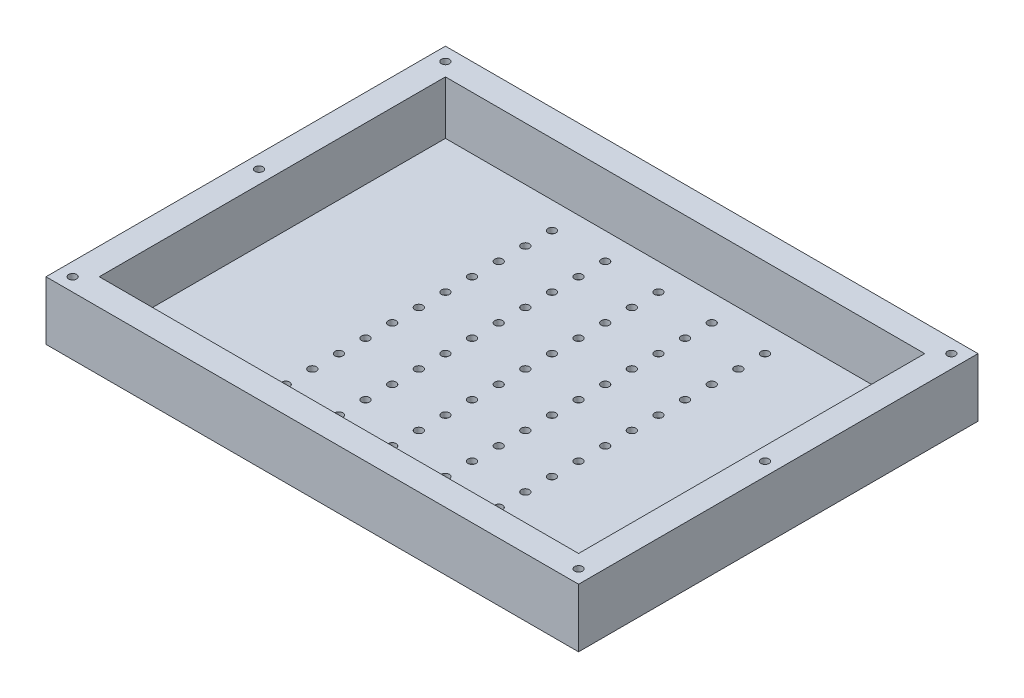
from build123d import *

# Parameters (mm, degrees)
SKETCH1_W           = 200
SKETCH1_H           = 150
BOSS_EXTRUDE1_DEPTH = 2
SKETCH2_R           = 1.5
CUT_EXTRUDE1_DEPTH  = 126.015998976
SKETCH3_W           = 200
SKETCH3_H           = 150
SKETCH3_W_2         = 180
SKETCH3_H_2         = 130
BOSS_EXTRUDE2_DEPTH = 20
SKETCH4_R           = 1.5
CUT_EXTRUDE2_DEPTH  = 127.921235418
SKETCH5_R           = 3
CUT_EXTRUDE3_DEPTH  = 17


with BuildPart() as part:
    # Sketch1 → Boss-Extrude1 (new body)
    with BuildSketch(Plane(origin=(0, 0, 0), x_dir=(1, 0, 0), z_dir=(0, 1, 0))):
        Rectangle(SKETCH1_W, SKETCH1_H)
    extrude(amount=BOSS_EXTRUDE1_DEPTH)

    # Sketch2 → Cut-Extrude1 (cut, through all)
    with BuildSketch(Plane(origin=(0, 2, 0), x_dir=(1, 0, 0), z_dir=(0, 1, 0))):
        with Locations(Location((0, -5, 0), (0, 0, 270))):
            Circle(SKETCH2_R)
        with Locations(Location((0, -15, 0), (0, 0, 270))):
            Circle(SKETCH2_R)
        with Locations(Location((0, -25, 0), (0, 0, 270))):
            Circle(SKETCH2_R)
        with Locations(Location((0, -35, 0), (0, 0, 270))):
            Circle(SKETCH2_R)
        with Locations(Location((0, -45, 0), (0, 0, 270))):
            Circle(SKETCH2_R)
        with Locations(Location((0, -55, 0), (0, 0, 270))):
            Circle(SKETCH2_R)
        with Locations(Location((0, 55, 0), (0, 0, 90))):
            Circle(SKETCH2_R)
        with Locations(Location((0, 45, 0), (0, 0, 90))):
            Circle(SKETCH2_R)
        with Locations(Location((0, 35, 0), (0, 0, 90))):
            Circle(SKETCH2_R)
        with Locations(Location((0, 25, 0), (0, 0, 90))):
            Circle(SKETCH2_R)
        with Locations(Location((0, 15, 0), (0, 0, 90))):
            Circle(SKETCH2_R)
        with Locations(Location((0, 5, 0), (0, 0, 90))):
            Circle(SKETCH2_R)
        with Locations(Location((20, -55, 0), (0, 0, 90))):
            Circle(SKETCH2_R)
        with Locations(Location((20, -45, 0), (0, 0, 90))):
            Circle(SKETCH2_R)
        with Locations(Location((20, -35, 0), (0, 0, 90))):
            Circle(SKETCH2_R)
        with Locations(Location((20, -25, 0), (0, 0, 90))):
            Circle(SKETCH2_R)
        with Locations(Location((20, -15, 0), (0, 0, 90))):
            Circle(SKETCH2_R)
        with Locations(Location((20, -5, 0), (0, 0, 90))):
            Circle(SKETCH2_R)
        with Locations(Location((20, 5, 0), (0, 0, 270))):
            Circle(SKETCH2_R)
        with Locations(Location((20, 15, 0), (0, 0, 270))):
            Circle(SKETCH2_R)
        with Locations(Location((20, 25, 0), (0, 0, 270))):
            Circle(SKETCH2_R)
        with Locations(Location((20, 35, 0), (0, 0, 270))):
            Circle(SKETCH2_R)
        with Locations(Location((20, 45, 0), (0, 0, 270))):
            Circle(SKETCH2_R)
        with Locations(Location((20, 55, 0), (0, 0, 270))):
            Circle(SKETCH2_R)
        with Locations(Location((-20, -55, 0), (0, 0, 90))):
            Circle(SKETCH2_R)
        with Locations(Location((-20, -45, 0), (0, 0, 90))):
            Circle(SKETCH2_R)
        with Locations(Location((-20, -35, 0), (0, 0, 90))):
            Circle(SKETCH2_R)
        with Locations(Location((-20, -25, 0), (0, 0, 90))):
            Circle(SKETCH2_R)
        with Locations(Location((-20, -15, 0), (0, 0, 90))):
            Circle(SKETCH2_R)
        with Locations(Location((-20, -5, 0), (0, 0, 90))):
            Circle(SKETCH2_R)
        with Locations(Location((-20, 5, 0), (0, 0, 270))):
            Circle(SKETCH2_R)
        with Locations(Location((-20, 15, 0), (0, 0, 270))):
            Circle(SKETCH2_R)
        with Locations(Location((-20, 25, 0), (0, 0, 270))):
            Circle(SKETCH2_R)
        with Locations(Location((-20, 35, 0), (0, 0, 270))):
            Circle(SKETCH2_R)
        with Locations(Location((-20, 45, 0), (0, 0, 270))):
            Circle(SKETCH2_R)
        with Locations(Location((-20, 55, 0), (0, 0, 270))):
            Circle(SKETCH2_R)
        with Locations(Location((40, -35, 0), (0, 0, 270))):
            Circle(SKETCH2_R)
        with Locations(Location((40, -45, 0), (0, 0, 270))):
            Circle(SKETCH2_R)
        with Locations(Location((40, -55, 0), (0, 0, 270))):
            Circle(SKETCH2_R)
        with Locations(Location((40, -5, 0), (0, 0, 270))):
            Circle(SKETCH2_R)
        with Locations(Location((40, -15, 0), (0, 0, 270))):
            Circle(SKETCH2_R)
        with Locations(Location((40, -25, 0), (0, 0, 270))):
            Circle(SKETCH2_R)
        with Locations(Location((40, 25, 0), (0, 0, 90))):
            Circle(SKETCH2_R)
        with Locations(Location((40, 15, 0), (0, 0, 90))):
            Circle(SKETCH2_R)
        with Locations(Location((40, 5, 0), (0, 0, 90))):
            Circle(SKETCH2_R)
        with Locations(Location((40, 55, 0), (0, 0, 90))):
            Circle(SKETCH2_R)
        with Locations(Location((40, 45, 0), (0, 0, 90))):
            Circle(SKETCH2_R)
        with Locations(Location((40, 35, 0), (0, 0, 90))):
            Circle(SKETCH2_R)
        with Locations(Location((-40, -55, 0), (0, 0, 270))):
            Circle(SKETCH2_R)
        with Locations(Location((-40, -45, 0), (0, 0, 270))):
            Circle(SKETCH2_R)
        with Locations(Location((-40, -35, 0), (0, 0, 270))):
            Circle(SKETCH2_R)
        with Locations(Location((-40, -25, 0), (0, 0, 270))):
            Circle(SKETCH2_R)
        with Locations(Location((-40, -15, 0), (0, 0, 270))):
            Circle(SKETCH2_R)
        with Locations(Location((-40, -5, 0), (0, 0, 270))):
            Circle(SKETCH2_R)
        with Locations(Location((-40, 15, 0), (0, 0, 90))):
            Circle(SKETCH2_R)
        with Locations(Location((-40, 5, 0), (0, 0, 90))):
            Circle(SKETCH2_R)
        with Locations(Location((-40, 35, 0), (0, 0, 90))):
            Circle(SKETCH2_R)
        with Locations(Location((-40, 25, 0), (0, 0, 90))):
            Circle(SKETCH2_R)
        with Locations(Location((-40, 55, 0), (0, 0, 90))):
            Circle(SKETCH2_R)
        with Locations(Location((-40, 45, 0), (0, 0, 90))):
            Circle(SKETCH2_R)
    extrude(amount=-CUT_EXTRUDE1_DEPTH, mode=Mode.SUBTRACT)

    # Sketch3 → Boss-Extrude2 (add)
    with BuildSketch(Plane(origin=(0, 2, 0), x_dir=(1, 0, 0), z_dir=(0, 1, 0))):
        Rectangle(SKETCH3_W, SKETCH3_H)
        Rectangle(SKETCH3_W_2, SKETCH3_H_2, mode=Mode.SUBTRACT)
    extrude(amount=BOSS_EXTRUDE2_DEPTH)

    # Sketch4 → Cut-Extrude2 (cut, through all)
    with BuildSketch(Plane.XZ):
        with Locations(Location((95, 70, 0), (0, 0, 270))):
            Circle(SKETCH4_R)
        with Locations(Location((95, -70, 0), (0, 0, 270))):
            Circle(SKETCH4_R)
        with Locations(Location((-95, 70, 0), (0, 0, 270))):
            Circle(SKETCH4_R)
        with Locations(Location((-95, -70, 0), (0, 0, 270))):
            Circle(SKETCH4_R)
        with Locations(Location((95, 0, 0), (0, 0, 270))):
            Circle(SKETCH4_R)
        with Locations(Location((-95, 0, 0), (0, 0, 270))):
            Circle(SKETCH4_R)
    extrude(amount=-CUT_EXTRUDE2_DEPTH, mode=Mode.SUBTRACT)

    # Sketch5 → Cut-Extrude3 (cut)
    with BuildSketch(Plane.XZ):
        with Locations(Location((95, 70, 0), (0, 0, 270))):
            Circle(SKETCH5_R)
        with Locations(Location((95, -70, 0), (0, 0, 270))):
            Circle(SKETCH5_R)
        with Locations(Location((-95, 70, 0), (0, 0, 270))):
            Circle(SKETCH5_R)
        with Locations(Location((-95, -70, 0), (0, 0, 270))):
            Circle(SKETCH5_R)
    extrude(amount=-CUT_EXTRUDE3_DEPTH, mode=Mode.SUBTRACT)


solid = part.part
